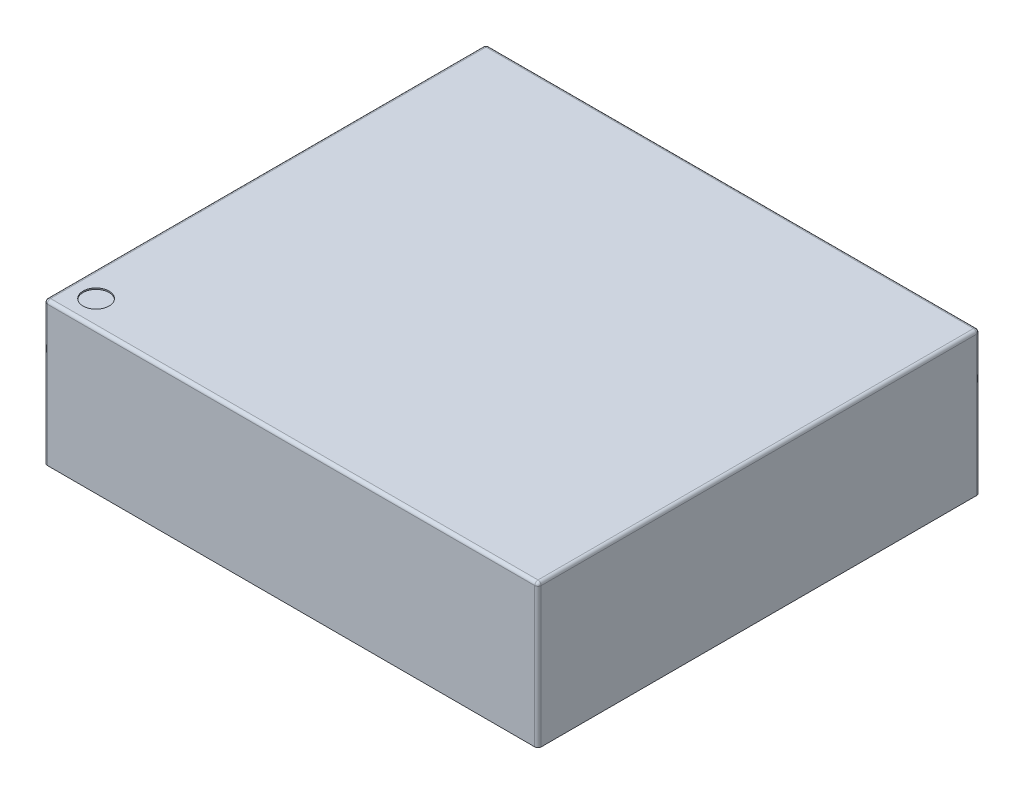
from build123d import *

# Parameters (mm, degrees)
SKETCH1_W           = 1.9
SKETCH1_H           = 1.7
BOSS_EXTRUDE1_DEPTH = 0.55
SKETCH2_R           = 0.05
CUT_EXTRUDE1_DEPTH  = 0.005
BOSS_EXTRUDE2_DEPTH = 0.018
FILLET1_R           = 0.0125


with BuildPart() as part:
    # Sketch1 → Boss-Extrude1 (new body)
    with BuildSketch(Plane(origin=(0, 0, 0), x_dir=(1, 0, 0), z_dir=(0, 1, 0))):
        Rectangle(SKETCH1_W, SKETCH1_H)
    extrude(amount=BOSS_EXTRUDE1_DEPTH)

    # Sketch2 → Cut-Extrude1 (cut)
    with BuildSketch(Plane(origin=(0, 0.55, 0), x_dir=(1, 0, 0), z_dir=(0, 1, 0))):
        with Locations(Location((-0.85, -0.75, 0), (0, 0, 270))):
            Circle(SKETCH2_R)
    extrude(amount=-CUT_EXTRUDE1_DEPTH, mode=Mode.SUBTRACT)

    # Sketch3 → Boss-Extrude2 (add)
    with BuildSketch(Plane.XZ):
        Polygon((-0.4, 0.473784773), (-0.5, 0.373784773), (-0.6, 0.373784773), (-0.6, 0.773784773), (-0.4, 0.773784773), align=None)
        Polygon((0, 0.373784773), (0.1, 0.373784773), (0.1, 0.473784773), (0.1, 0.773784773), (-0.1, 0.773784773), (-0.1, 0.373784773), align=None)
        Polygon((-0.5, -0.373784773), (-0.6, -0.373784773), (-0.6, -0.773784773), (-0.4, -0.773784773), (-0.4, -0.473784773), (-0.4, -0.373784773), align=None)
        Polygon((-0.1, -0.373784773), (-0.1, -0.773784773), (0.1, -0.773784773), (0.1, -0.473784773), (0.1, -0.373784773), (0, -0.373784773), align=None)
        Polygon((0.6, -0.773784773), (0.4, -0.773784773), (0.4, -0.473784773), (0.4, -0.373784773), (0.5, -0.373784773), (0.6, -0.373784773), align=None)
    extrude(amount=BOSS_EXTRUDE2_DEPTH)

    # Fillet1
    fillet1_edges = [part.edges().sort_by_distance(p)[0] for p in [
        (-0.95, 0.55, 0),
        (0, 0.55, 0.85),
        (0.95, 0.55, 0),
        (0.95, 0.275, 0.85),
        (-0.95, 0.275, 0.85),
        (-0.95, 0.275, -0.85),
        (0.95, 0.275, -0.85),
        (0, 0.55, -0.85),
    ]]
    fillet(fillet1_edges, radius=FILLET1_R)


solid = part.part
